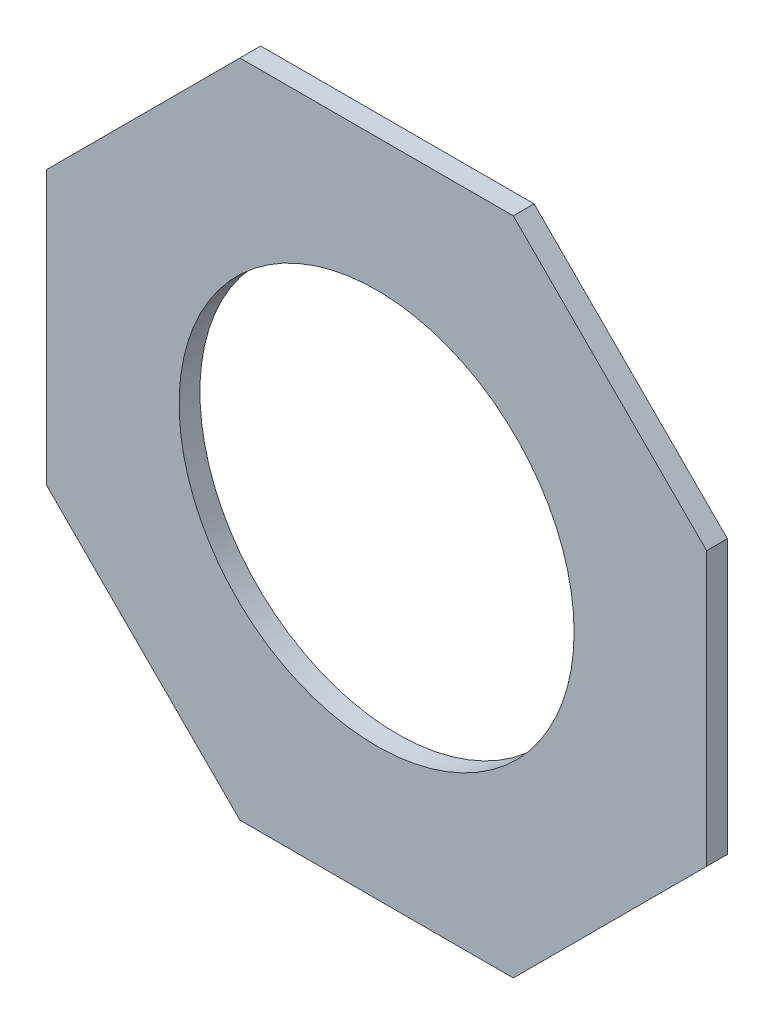
from build123d import *

# Parameters (mm, degrees)
SKETCH1_R           = 9.5
BOSS_EXTRUDE1_DEPTH = 1


with BuildPart() as part:
    # Sketch1 → Boss-Extrude1 (new body)
    with BuildSketch(Plane.XY):
        Polygon((6.575640303, 15.875), (-6.575640303, 15.875), (-15.875, 6.575640303), (-15.875, -6.575640303), (-6.575640303, -15.875), (6.575640303, -15.875), (15.875, -6.575640303), (15.875, 6.575640303), align=None)
        Circle(SKETCH1_R, mode=Mode.SUBTRACT)
    extrude(amount=BOSS_EXTRUDE1_DEPTH)


solid = part.part
